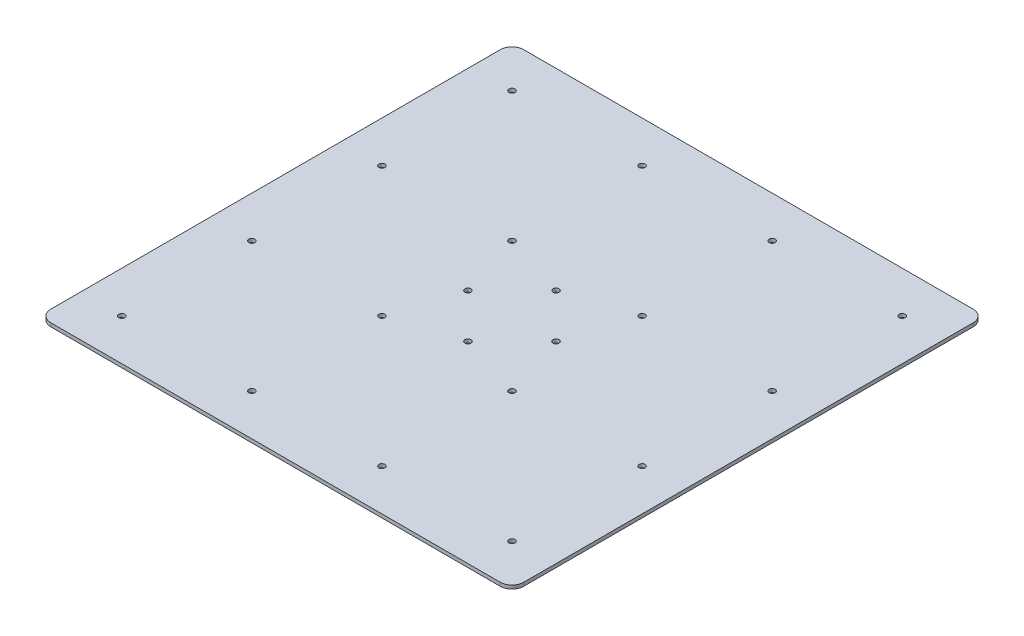
from build123d import *

# Parameters (mm, degrees)
SKETCH1_W           = 400
SKETCH1_H           = 400
BOSS_EXTRUDE1_DEPTH = 3
SKETCH3_R           = 2.58
CUT_EXTRUDE1_DEPTH  = 283.85862193
SKETCH4_R           = 2.58
CUT_EXTRUDE2_DEPTH  = 283.85862193
FILLET1_R           = 10


with BuildPart() as part:
    # Sketch1 → Boss-Extrude1 (new body)
    with BuildSketch(Plane(origin=(0, 0, 0), x_dir=(1, 0, 0), z_dir=(0, 1, 0))):
        Rectangle(SKETCH1_W, SKETCH1_H)
    extrude(amount=BOSS_EXTRUDE1_DEPTH)

    # Sketch3 → Cut-Extrude1 (cut, through all)
    with BuildSketch(Plane(origin=(0, 3, 0), x_dir=(1, 0, 0), z_dir=(0, 1, 0))):
        with Locations(Location((-37.25, 0, 0), (0, 0, 270))):
            Circle(SKETCH3_R)
        with Locations(Location((0, 37.25, 0), (0, 0, 270))):
            Circle(SKETCH3_R)
        with Locations(Location((37.25, 0, 0), (0, 0, 270))):
            Circle(SKETCH3_R)
        with Locations(Location((0, -37.25, 0), (0, 0, 270))):
            Circle(SKETCH3_R)
    extrude(amount=-CUT_EXTRUDE1_DEPTH, mode=Mode.SUBTRACT)

    # Sketch4 → Cut-Extrude2 (cut, through all)
    with BuildSketch(Plane(origin=(0, 3, 0), x_dir=(1, 0, 0), z_dir=(0, 1, 0))):
        with Locations(Location((-165, 165, 0), (0, 0, 270))):
            Circle(SKETCH4_R)
        with Locations(Location((-55, 165, 0), (0, 0, 270))):
            Circle(SKETCH4_R)
        with Locations(Location((55, 165, 0), (0, 0, 270))):
            Circle(SKETCH4_R)
        with Locations(Location((165, 165, 0), (0, 0, 270))):
            Circle(SKETCH4_R)
        with Locations(Location((-55, 55, 0), (0, 0, 270))):
            Circle(SKETCH4_R)
        with Locations(Location((55, 55, 0), (0, 0, 270))):
            Circle(SKETCH4_R)
        with Locations(Location((165, 55, 0), (0, 0, 270))):
            Circle(SKETCH4_R)
        with Locations(Location((-55, -55, 0), (0, 0, 270))):
            Circle(SKETCH4_R)
        with Locations(Location((55, -55, 0), (0, 0, 270))):
            Circle(SKETCH4_R)
        with Locations(Location((165, -55, 0), (0, 0, 270))):
            Circle(SKETCH4_R)
        with Locations(Location((-55, -165, 0), (0, 0, 270))):
            Circle(SKETCH4_R)
        with Locations(Location((55, -165, 0), (0, 0, 270))):
            Circle(SKETCH4_R)
        with Locations(Location((165, -165, 0), (0, 0, 270))):
            Circle(SKETCH4_R)
        with Locations(Location((-165, 55, 0), (0, 0, 270))):
            Circle(SKETCH4_R)
        with Locations(Location((-165, -55, 0), (0, 0, 270))):
            Circle(SKETCH4_R)
        with Locations(Location((-165, -165, 0), (0, 0, 270))):
            Circle(SKETCH4_R)
    extrude(amount=-CUT_EXTRUDE2_DEPTH, mode=Mode.SUBTRACT)

    # Fillet1
    fillet1_edges = [part.edges().sort_by_distance(p)[0] for p in [
        (200, 1.5, 200),
        (-200, 1.5, 200),
        (-200, 1.5, -200),
        (200, 1.5, -200),
    ]]
    fillet(fillet1_edges, radius=FILLET1_R)


solid = part.part
